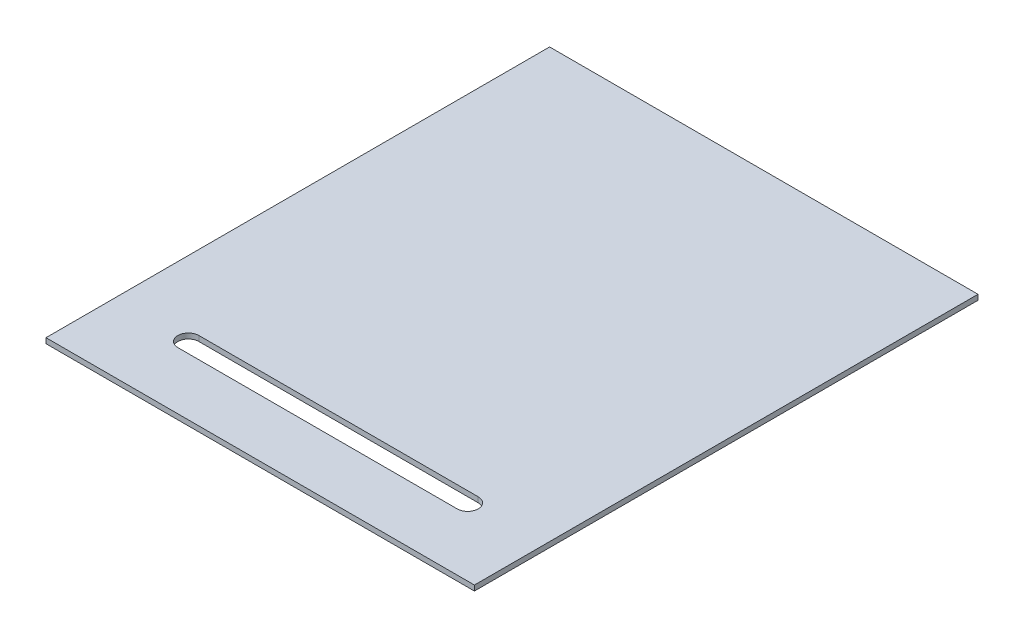
from build123d import *

# Parameters (mm, degrees)
SKETCH1_W           = 259.08
SKETCH1_H           = 304.546
BOSS_EXTRUDE1_DEPTH = 3.175


with BuildPart() as part:
    # Sketch1 → Boss-Extrude1 (new body)
    with BuildSketch(Plane(origin=(0, 0, 0), x_dir=(1, 0, 0), z_dir=(0, 1, 0))):
        Rectangle(SKETCH1_W, SKETCH1_H)
        with BuildLine():
            Line((-84.455, -104.902), (84.455, -104.902))
            ThreePointArc((84.455, -104.902), (90.805, -111.252), (84.455, -117.602))
            Line((84.455, -117.602), (-84.455, -117.602))
            ThreePointArc((-84.455, -117.602), (-90.805, -111.252), (-84.455, -104.902))
        make_face(mode=Mode.SUBTRACT)
    extrude(amount=BOSS_EXTRUDE1_DEPTH)


solid = part.part
